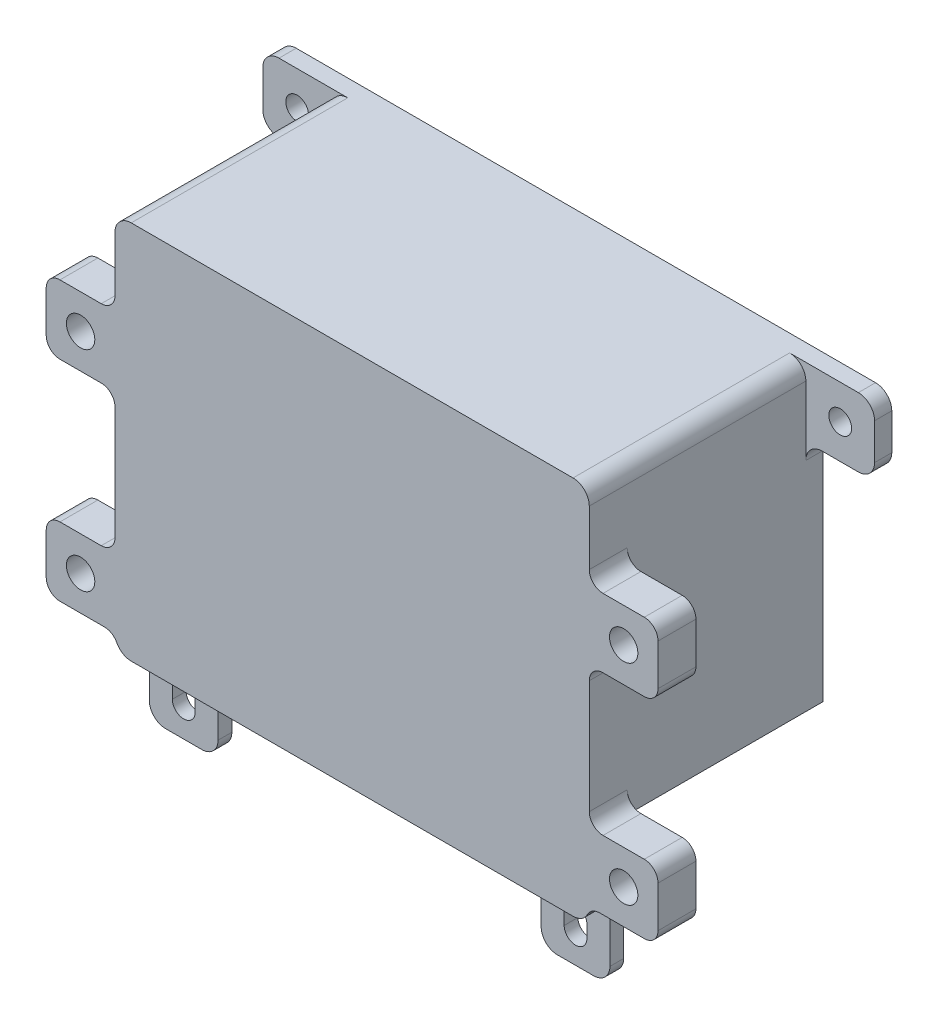
from build123d import *

# Parameters (mm, degrees)
SKETCH1_W           = 82.539998569
SKETCH1_H           = 65.04
BOSS_EXTRUDE1_DEPTH = 43.18
SHELL1_T            = 2.54
CUT_EXTRUDE2_DEPTH  = 124.028758627
SKETCH7_W           = 87.619998569
SKETCH7_H           = 43.18
BOSS_EXTRUDE2_DEPTH = 2.54
CUT_EXTRUDE3_DEPTH  = 2.54
CUT_EXTRUDE4_DEPTH  = 2.54
SKETCH10_W          = 1.27
SKETCH10_H          = 35.56
CUT_EXTRUDE5_DEPTH  = 2.54
SKETCH11_W          = 12.7
SKETCH11_H          = 2.54
BOSS_EXTRUDE3_DEPTH = 12.7
CUT_EXTRUDE7_DEPTH  = 125.717897357
SKETCH13_W          = 12.7
SKETCH13_H          = 12.7
SKETCH13_R          = 2.1
BOSS_EXTRUDE4_DEPTH = 3.175
FILLET2_R           = 3
SKETCH14_W          = 12.7
SKETCH14_H          = 12.7
SKETCH14_R          = 2.625
BOSS_EXTRUDE5_DEPTH = 7
FILLET3_R           = 2.54


with BuildPart() as part:
    # Sketch1 → Boss-Extrude1 (new body)
    with BuildSketch(Plane.XY):
        with Locations((47.599999189, 40.75)):
            Rectangle(SKETCH1_W, SKETCH1_H)
    extrude(amount=BOSS_EXTRUDE1_DEPTH)

    # Shell1
    shell1_openings = [part.faces().sort_by_distance(p)[0] for p in [
        (47.599999189, 73.27, 21.59),
        (47.599999189, 40.75, 0),
    ]]
    offset(amount=SHELL1_T, openings=shell1_openings, kind=Kind.INTERSECTION)

    # Sketch6 → Cut-Extrude2 (cut, through all)
    with BuildSketch(Plane.ZY.offset(-3.789999905)):
        Polygon((2.54, 59.03), (2.54, 73.27), (0, 73.27), (0, 59.03), (0, 3.15), (38.1, 3.15), (38.1, 19.92924), (2.54, 19.92924), align=None)
    extrude(amount=-CUT_EXTRUDE2_DEPTH, mode=Mode.SUBTRACT)

    # Sketch7 → Boss-Extrude2 (add)
    with BuildSketch(Plane(origin=(0, 73.27, 0), x_dir=(1, 0, 0), z_dir=(0, 1, 0))):
        with Locations((47.59999919, -24.13)):
            Rectangle(SKETCH7_W, SKETCH7_H)
    extrude(amount=BOSS_EXTRUDE2_DEPTH)

    # Sketch8 → Cut-Extrude3 (cut)
    with BuildSketch(Plane(origin=(0, 0, 2.54), x_dir=(-1, 0, 0), z_dir=(0, 0, -1))):
        Polygon((-65.405564728, 73.27), (-65.405564728, 74.54), (-90.139998474, 74.54), (-90.139998474, 19.92924), (-88.869998474, 19.92924), (-88.869998474, 73.27), align=None)
        Polygon((-5.059999905, 74.54), (-65.405564728, 74.54), (-65.405564728, 73.27), (-6.329999905, 73.27), (-6.329999905, 19.92924), (-5.059999905, 19.92924), align=None)
    extrude(amount=-CUT_EXTRUDE3_DEPTH, mode=Mode.SUBTRACT)

    # Sketch9 → Cut-Extrude4 (cut)
    with BuildSketch(Plane(origin=(0, 0, 38.1), x_dir=(-1, 0, 0), z_dir=(0, 0, -1))):
        Polygon((-90.139998474, 19.92924), (-90.139998474, 6.96), (-5.059999905, 6.96), (-5.059999905, 19.92924), (-6.329999905, 19.92924), (-6.329999905, 8.23), (-88.869998474, 8.23), (-88.869998474, 19.92924), align=None)
    extrude(amount=-CUT_EXTRUDE4_DEPTH, mode=Mode.SUBTRACT)

    # Sketch10 → Cut-Extrude5 (cut)
    with BuildSketch(Plane.XZ.offset(-19.92924)):
        with Locations((5.694999905, 22.86)):
            Rectangle(SKETCH10_W, SKETCH10_H)
        with Locations((89.504998474, 22.86)):
            Rectangle(SKETCH10_W, SKETCH10_H)
    extrude(amount=-CUT_EXTRUDE5_DEPTH, mode=Mode.SUBTRACT)

    # Sketch11 → Boss-Extrude3 (add)
    with BuildSketch(Plane.XZ.offset(-5.69)):
        with Locations((11.409999905, 39.37)):
            Rectangle(SKETCH11_W, SKETCH11_H)
        with Locations((83.789998474, 39.37)):
            Rectangle(SKETCH11_W, SKETCH11_H)
    extrude(amount=BOSS_EXTRUDE3_DEPTH)

    # Sketch12 → Cut-Extrude7 (cut, through all)
    with BuildSketch(Plane.XY.offset(40.64)):
        with BuildLine():
            Line((9.309999905, 0.61), (9.309999905, -1.683510845))
            ThreePointArc((9.309999905, -1.683510845), (11.409999905, -3.783510845), (13.509999905, -1.683510845))
            Line((13.509999905, -1.683510845), (13.509999905, 0.61))
            ThreePointArc((13.509999905, 0.61), (11.409999905, 2.71), (9.309999905, 0.61))
        make_face()
        with BuildLine():
            Line((81.689998474, 0.61), (81.689998474, -1.683510845))
            ThreePointArc((81.689998474, -1.683510845), (83.789998474, -3.783510845), (85.889998474, -1.683510845))
            Line((85.889998474, -1.683510845), (85.889998474, 0.61))
            ThreePointArc((85.889998474, 0.61), (83.789998474, 2.71), (81.689998474, 0.61))
        make_face()
    extrude(amount=-CUT_EXTRUDE7_DEPTH, mode=Mode.SUBTRACT)

    # Sketch13 → Boss-Extrude4 (add)
    # profile 1 of 2: a face of its own
    with BuildSketch(Plane(origin=(0, 0, 2.54), x_dir=(-1, 0, 0), z_dir=(0, 0, -1))):
        with Locations((-97.759998474, 69.46)):
            Rectangle(SKETCH13_W, SKETCH13_H)
        with Locations((-97.759998474, 69.46)):
            Circle(SKETCH13_R, mode=Mode.SUBTRACT)
    # profile 2 of 2: a face of its own
    with BuildSketch(Plane(origin=(0, 0, 2.54), x_dir=(-1, 0, 0), z_dir=(0, 0, -1))):
        with Locations((2.560000095, 69.46)):
            Rectangle(SKETCH13_W, SKETCH13_H)
        with Locations((2.560000095, 69.46)):
            Circle(SKETCH13_R, mode=Mode.SUBTRACT)
    extrude(amount=-BOSS_EXTRUDE4_DEPTH)

    # Fillet2
    fillet2_edges = [part.edges().sort_by_distance(p)[0] for p in [
        (77.439998474, 5.69, 39.37),
        (77.439998474, -7.01, 39.37),
        (90.139998474, -7.01, 39.37),
        (17.759999905, -7.01, 39.37),
        (5.059999905, -7.01, 39.37),
        (17.759999905, 5.69, 39.37),
        (3.789999905, 63.11, 4.1275),
        (-8.910000095, 63.11, 4.1275),
        (-8.910000095, 75.81, 4.1275),
        (91.409998474, 63.11, 4.1275),
        (104.109998474, 63.11, 4.1275),
        (104.109998474, 75.81, 4.1275),
        (91.409998474, 75.81, 25.7175),
        (3.789999905, 75.81, 25.7175),
        (3.789999905, 5.69, 41.91),
        (91.409998474, 5.69, 41.91),
    ]]
    fillet(fillet2_edges, radius=FILLET2_R)

    # Sketch14 → Boss-Extrude5 (add)
    # profile 1 of 4: a face of its own
    with BuildSketch(Plane.XY.offset(45.72)):
        with Locations((-2.560000095, 53.76)):
            Rectangle(SKETCH14_W, SKETCH14_H)
        with Locations((-2.560000095, 53.76)):
            Circle(SKETCH14_R, mode=Mode.SUBTRACT)
    # profile 2 of 4: a face of its own
    with BuildSketch(Plane.XY.offset(45.72)):
        with Locations((-2.560000095, 15.04)):
            Rectangle(SKETCH14_W, SKETCH14_H)
        with Locations((-2.560000095, 15.04)):
            Circle(SKETCH14_R, mode=Mode.SUBTRACT)
    # profile 3 of 4: a face of its own
    with BuildSketch(Plane.XY.offset(45.72)):
        with Locations((97.759998474, 15.04)):
            Rectangle(SKETCH14_W, SKETCH14_H)
        with Locations(Location((97.759998474, 15.04, 0), (0, 0, 180))):
            Circle(SKETCH14_R, mode=Mode.SUBTRACT)
    # profile 4 of 4: a face of its own
    with BuildSketch(Plane.XY.offset(45.72)):
        with Locations((97.759998474, 53.76)):
            Rectangle(SKETCH14_W, SKETCH14_H)
        with Locations(Location((97.759998474, 53.76, 0), (0, 0, 180))):
            Circle(SKETCH14_R, mode=Mode.SUBTRACT)
    extrude(amount=-BOSS_EXTRUDE5_DEPTH)

    # Fillet3
    fillet3_edges = [part.edges().sort_by_distance(p)[0] for p in [
        (91.409998474, 8.69, 42.22),
        (3.789999905, 60.11, 42.22),
        (3.789999905, 47.41, 42.22),
        (-8.910000095, 47.41, 42.22),
        (-8.910000095, 60.11, 42.22),
        (3.789999905, 21.39, 42.22),
        (3.789999905, 8.69, 42.22),
        (-8.910000095, 8.69, 42.22),
        (-8.910000095, 21.39, 42.22),
        (91.409998474, 21.39, 42.22),
        (104.109998474, 21.39, 42.22),
        (104.109998474, 8.69, 42.22),
        (91.409998474, 47.41, 42.22),
        (91.409998474, 60.11, 42.22),
        (104.109998474, 60.11, 42.22),
        (104.109998474, 47.41, 42.22),
    ]]
    fillet(fillet3_edges, radius=FILLET3_R)


solid = part.part
